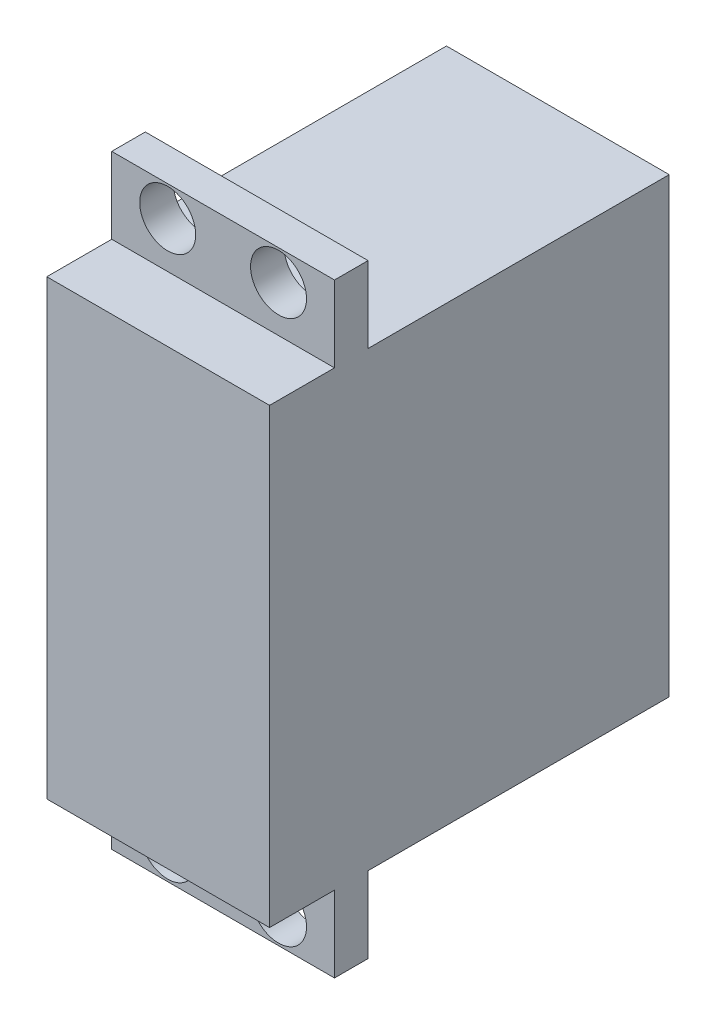
from build123d import *

# Parameters (mm, degrees)
SKETCH4_W               = 19.9
SKETCH4_H               = 40.4
BOSS_EXTRUDE3_DEPTH     = 17.85
SKETCH6_W               = 19.9
SKETCH6_H               = 54
BOSS_EXTRUDE4_DEPTH     = 3
CUT_EXTRUDE2_DEPTH      = 34.861851692
CUT_EXTRUDE2_DEPTH_BACK = 34.861851692
SKETCH1_R               = 2.5


with BuildPart() as part:
    # Sketch4 → Boss-Extrude3 (new, symmetric)
    with BuildSketch(Plane.XY):
        Rectangle(SKETCH4_W, SKETCH4_H)
    extrude(amount=BOSS_EXTRUDE3_DEPTH, both=True)

    # Sketch6 → Boss-Extrude4 (add)
    with BuildSketch(Plane(origin=(0, 0, 9.05), x_dir=(-1, 0, 0), z_dir=(0, 0, -1))):
        Rectangle(SKETCH6_W, SKETCH6_H)
    extrude(amount=-BOSS_EXTRUDE4_DEPTH)

    # Sketch1 → Cut-Extrude2 (cut, two sides: drawn at the far end of the back side and taken through both)
    with BuildSketch(Plane.XY.offset(-CUT_EXTRUDE2_DEPTH_BACK)):
        with Locations((4.95, -24.3)):
            Circle(SKETCH1_R)
        with Locations((-4.95, -24.3)):
            Circle(SKETCH1_R)
        with Locations((-4.95, 24.3)):
            Circle(SKETCH1_R)
        with Locations((4.95, 24.3)):
            Circle(SKETCH1_R)
    extrude(amount=CUT_EXTRUDE2_DEPTH + CUT_EXTRUDE2_DEPTH_BACK, mode=Mode.SUBTRACT)


solid = part.part
